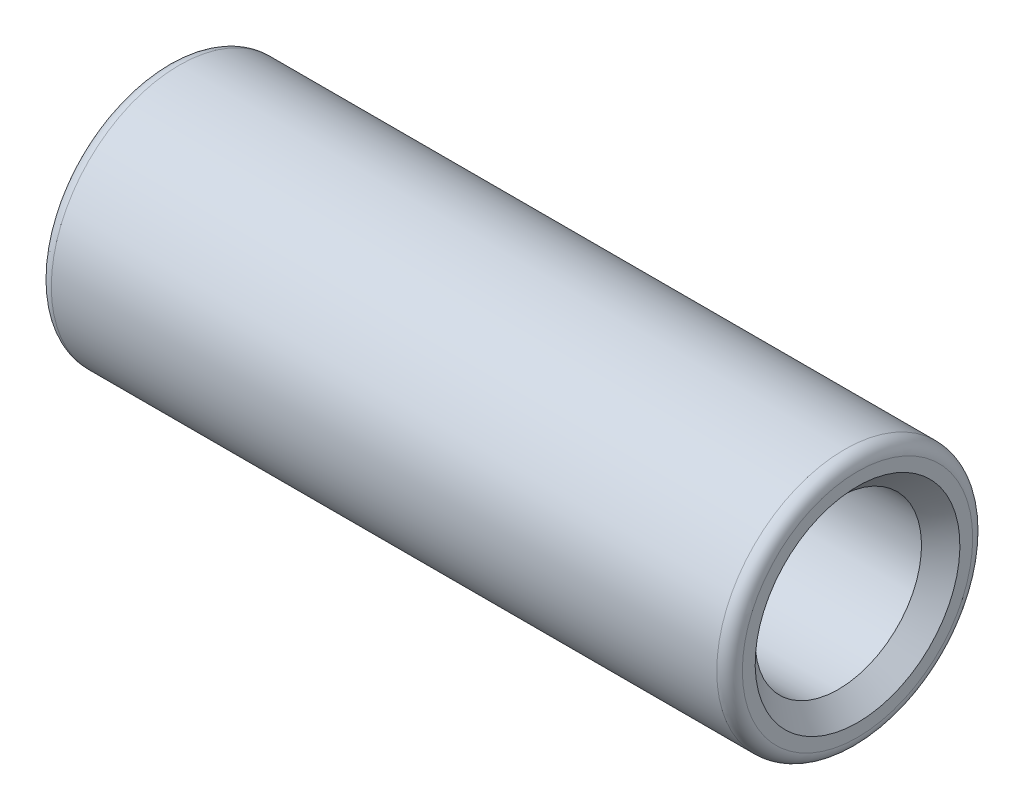
from build123d import *

# Parameters (mm, degrees)
CHAMFER1_SIZE = 1.5
FILLET1_R     = 1


with BuildPart() as part:
    # Sketch1 → Revolve1 (revolve)
    with BuildSketch(Plane.XY, mode=Mode.PRIVATE) as revolve1_sk:
        Polygon((25, 4.05), (0, 4.05), (0, 10), (54, 10), (54, 6.5), (30, 6.5), (30, 2.775), (36, 2.775), (36, 0), (25, 0), align=None)
    revolve(revolve1_sk.sketch.rotate(Axis((0, 0, 0), (1, 0, 0)), 180), axis=Axis((0, 0, 0), (1, 0, 0)))

    # Chamfer1
    chamfer1_edges = [part.edges().sort_by_distance(p)[0] for p in [
        (0, 4.05, 0),
        (36, 2.775, 0),
        (54, 6.5, 0),
    ]]
    chamfer(chamfer1_edges, length=CHAMFER1_SIZE)

    # Fillet1
    fillet1_edges = [part.edges().sort_by_distance(p)[0] for p in [
        (54, 10, 0),
        (0, 10, 0),
    ]]
    fillet(fillet1_edges, radius=FILLET1_R)


solid = part.part
